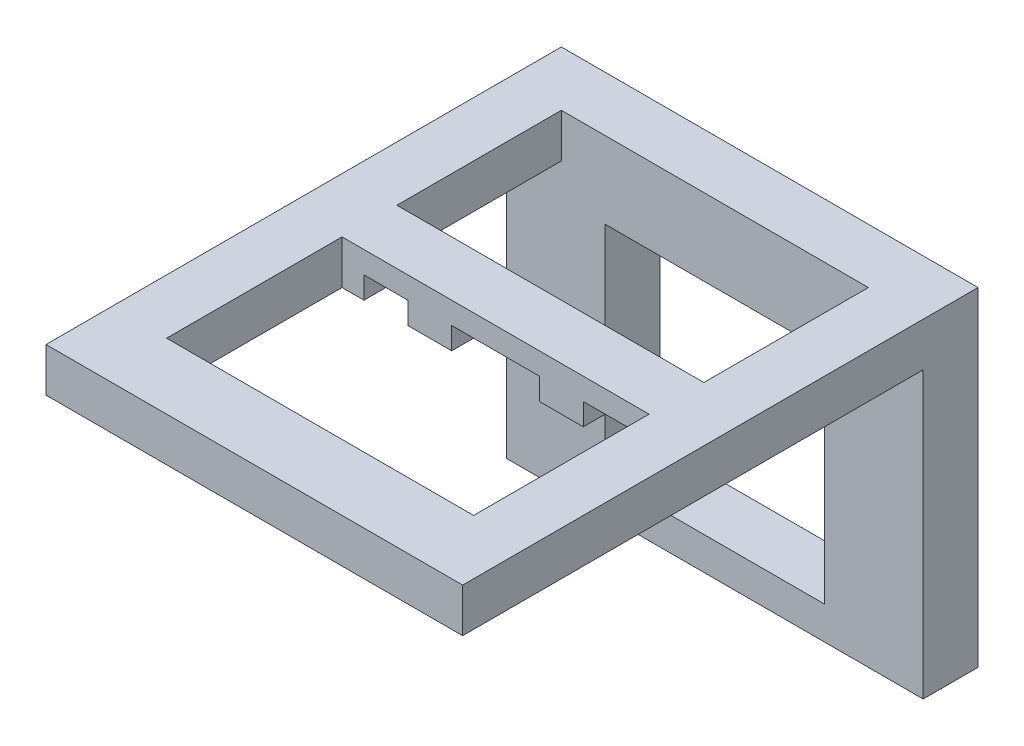
from build123d import *

# Parameters (mm, degrees)
SKETCH_3_W          = 10
SKETCH_3_H          = 1.5
EXTRUDE_1_DEPTH     = 2.5
EXTRUDE_2_DEPTH     = 2
CUT_EXTRUDE_1_REACH = 27.584
SKETCH_6_W          = 2
SKETCH_6_H          = 1
SKETCH_6_W_2        = 4


with BuildPart() as part:
    # 草图3 → 凸台-拉伸1 (new body)
    with BuildSketch(Plane.XY):
        Polygon((5, 7.602908894), (5, -2.397091106), (-5, -2.397091106), (-5, 7.602908894), (-5, 9.102908894), (-9.5, 9.102908894), (-9.5, -3.897091106), (9.5, -3.897091106), (9.5, 9.102908894), (5, 9.102908894), align=None)
        with Locations((0, 8.352908894)):
            Rectangle(SKETCH_3_W, SKETCH_3_H)
    extrude(amount=EXTRUDE_1_DEPTH)

    # 草图4 → 凸台-拉伸2 (add)
    with BuildSketch(Plane(origin=(0, 9.102908894, 0), x_dir=(1, 0, 0), z_dir=(0, 1, 0))):
        Polygon((9.5, -2.5), (9.5, 0), (0, 0), (0, -2.5), (7, -2.5), align=None)
        Polygon((0, -2.5), (0, 0), (-9.5, 0), (-9.5, -2.5), (-7, -2.5), align=None)
        Polygon((-7, -2.5), (-9.5, -2.5), (-9.5, -23.5), (0, -23.5), (0, -20.5), (-7, -20.5), (-7, -12.5), (0, -12.5), (0, -10), (-7, -10), align=None)
        Polygon((9.5, -23.5), (9.5, -2.5), (7, -2.5), (7, -10), (0, -10), (0, -12.5), (7, -12.5), (7, -20.5), (0, -20.5), (0, -23.5), align=None)
    extrude(amount=EXTRUDE_2_DEPTH)

    # 草图6 → 切除-拉伸1 (cut, up to next)
    with BuildSketch(Plane.XY.offset(2.5), mode=Mode.PRIVATE) as cut_extrude_1_sk1:
        with Locations((-5, 9.602908894)):
            Rectangle(SKETCH_6_W, SKETCH_6_H)
    cut_extrude_1_tool1 = extrude(cut_extrude_1_sk1.sketch, amount=CUT_EXTRUDE_1_REACH, mode=Mode.PRIVATE) & part.part
    # 草图6 → 切除-拉伸1 (cut, up to next)
    with BuildSketch(Plane.XY.offset(2.5), mode=Mode.PRIVATE) as cut_extrude_1_sk2:
        with Locations((5, 9.602908894)):
            Rectangle(SKETCH_6_W, SKETCH_6_H)
    cut_extrude_1_tool2 = extrude(cut_extrude_1_sk2.sketch, amount=CUT_EXTRUDE_1_REACH, mode=Mode.PRIVATE) & part.part
    # 草图6 → 切除-拉伸1 (cut, up to next)
    with BuildSketch(Plane.XY.offset(2.5), mode=Mode.PRIVATE) as cut_extrude_1_sk3:
        with Locations((0, 9.602908894)):
            Rectangle(SKETCH_6_W_2, SKETCH_6_H)
    cut_extrude_1_tool3 = extrude(cut_extrude_1_sk3.sketch, amount=CUT_EXTRUDE_1_REACH, mode=Mode.PRIVATE) & part.part
    add(cut_extrude_1_tool1.solids().sort_by_distance((-5, 9.602909, 2.5))[0], mode=Mode.SUBTRACT)
    add(cut_extrude_1_tool2.solids().sort_by_distance((5, 9.602909, 2.5))[0], mode=Mode.SUBTRACT)
    add(cut_extrude_1_tool3.solids().sort_by_distance((0, 9.602909, 2.5))[0], mode=Mode.SUBTRACT)


solid = part.part
